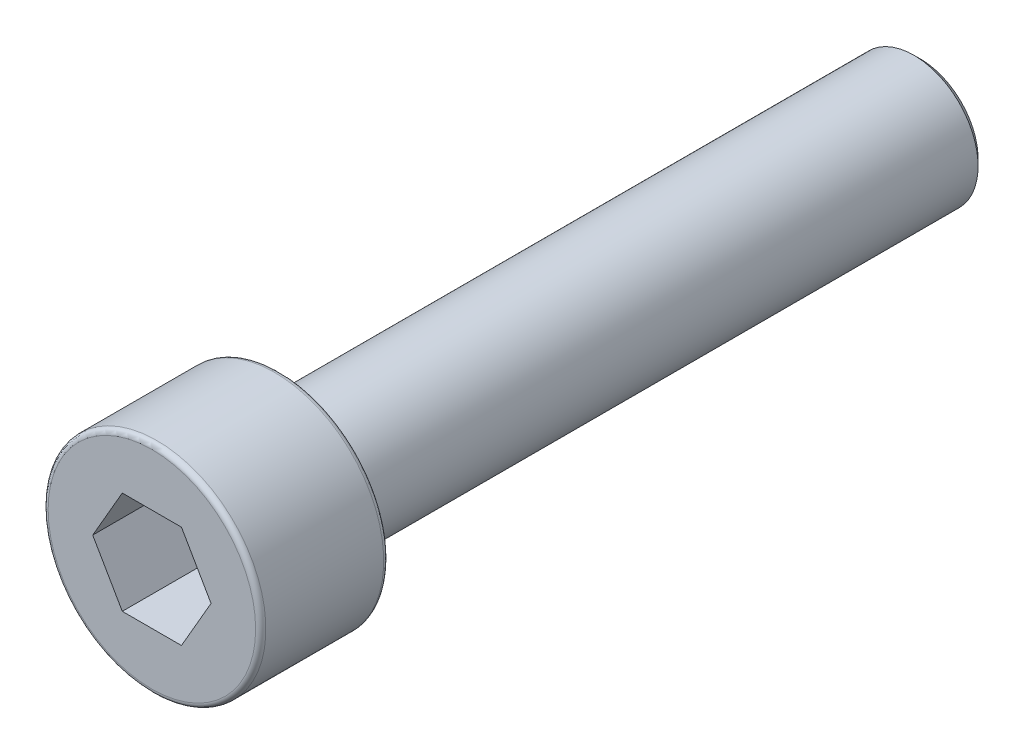
from build123d import *

# Parameters (mm, degrees)
SKETCH1_R           = 4.25
BOSS_EXTRUDE1_DEPTH = 5
SKETCH2_R           = 2.5
BOSS_EXTRUDE2_DEPTH = 25
CUT_EXTRUDE1_DEPTH  = 4
CHAMFER1_SIZE       = 0.25
FILLET1_R           = 0.2


with BuildPart() as part:
    # Sketch1 → Boss-Extrude1 (new body)
    with BuildSketch(Plane.XY.offset(30)):
        Circle(SKETCH1_R)
    extrude(amount=-BOSS_EXTRUDE1_DEPTH)

    # Sketch2 → Boss-Extrude2 (add)
    with BuildSketch(Plane(origin=(0, 0, 25), x_dir=(-1, 0, 0), z_dir=(0, 0, -1))):
        Circle(SKETCH2_R)
    extrude(amount=BOSS_EXTRUDE2_DEPTH)

    # Sketch3 → Cut-Extrude1 (cut)
    with BuildSketch(Plane.XY.offset(30)):
        Polygon((-2.309401077, 0), (-1.154700538, -2), (1.154700538, -2), (2.309401077, 0), (1.154700538, 2), (-1.154700538, 2), align=None)
    extrude(amount=-CUT_EXTRUDE1_DEPTH, mode=Mode.SUBTRACT)

    # Chamfer1
    chamfer1_edges = [part.edges().sort_by_distance(p)[0] for p in [
        (2.5, 0, 0),
    ]]
    chamfer(chamfer1_edges, length=CHAMFER1_SIZE)

    # Fillet1
    fillet1_edges = [part.edges().sort_by_distance(p)[0] for p in [
        (-4.25, 0, 25),
        (-4.25, 0, 30),
    ]]
    fillet(fillet1_edges, radius=FILLET1_R)


solid = part.part
